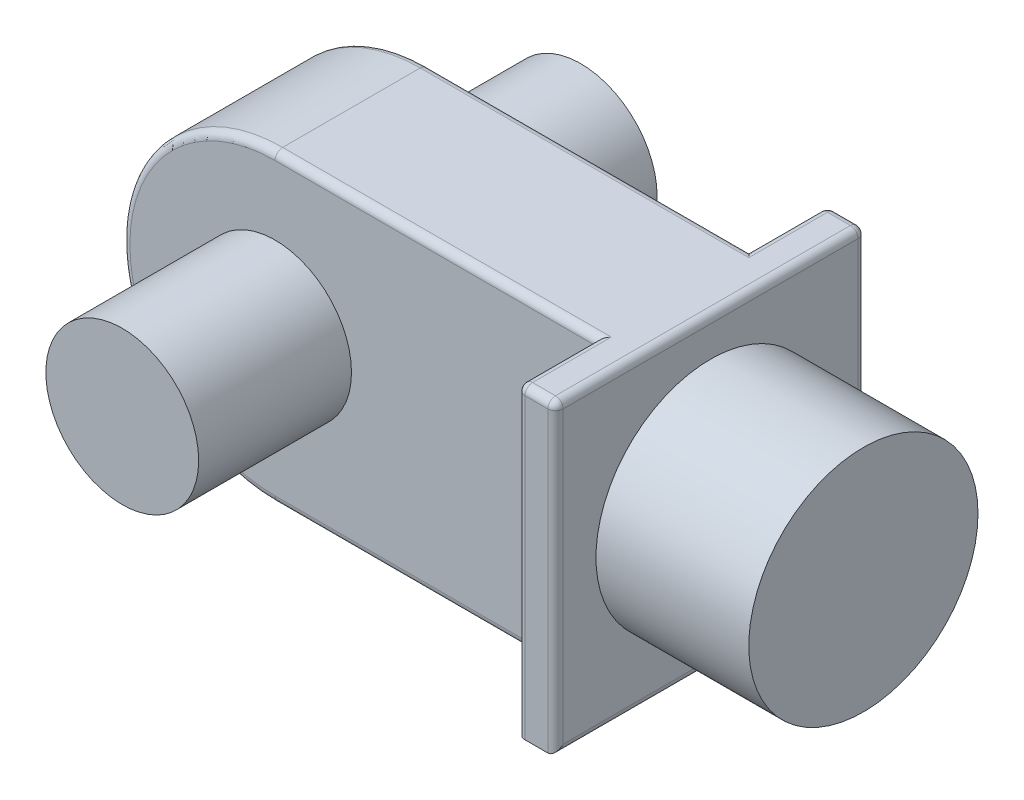
from build123d import *

# Parameters (mm, degrees)
BOSS_EXTRUDE1_DEPTH = 20
SKETCH2_R           = 10
BOSS_EXTRUDE2_DEPTH = 20
SKETCH3_W           = 40.597946668
SKETCH3_H           = 40
BOSS_EXTRUDE3_DEPTH = 5
SKETCH4_R           = 15
BOSS_EXTRUDE4_DEPTH = 20
FILLET1_R           = 1
L_EK2_SCALE         = 0.2


with BuildPart() as part:
    # Sketch1 → Boss-Extrude1 (new body)
    with BuildSketch(Plane.XY):
        with BuildLine():
            Line((-42, 20), (0, 20))
            Line((0, 20), (0, -20))
            Line((0, -20), (-42, -20))
            ThreePointArc((-42, -20), (-62, 0), (-42, 20))
        make_face()
    extrude(amount=BOSS_EXTRUDE1_DEPTH)

    # Sketch2 → Boss-Extrude2 (add)
    with BuildSketch(Plane.XY.offset(20)):
        with Locations((-42, 0)):
            Circle(SKETCH2_R)
    boss_extrude2 = extrude(amount=BOSS_EXTRUDE2_DEPTH)

    # Mirror1: Boss-Extrude2 across plane
    add(boss_extrude2.mirror(Plane.XY.offset(10)))

    # Sketch3 → Boss-Extrude3 (add)
    with BuildSketch(Plane(origin=(0, 0, 0), x_dir=(0, 0, -1), z_dir=(1, 0, 0))):
        with Locations((-10, 0)):
            Rectangle(SKETCH3_W, SKETCH3_H)
    extrude(amount=BOSS_EXTRUDE3_DEPTH)

    # Sketch4 → Boss-Extrude4 (add)
    with BuildSketch(Plane(origin=(5, 0, 0), x_dir=(0, 0, -1), z_dir=(1, 0, 0))):
        with Locations((-10, 0)):
            Circle(SKETCH4_R)
    extrude(amount=BOSS_EXTRUDE4_DEPTH)

    # Fillet1
    fillet1_edges = [part.edges().sort_by_distance(p)[0] for p in [
        (-21, 20, 20),
        (0, 0, -10.298973334),
        (0, 20, -5.149486667),
        (0, 20, 25.149486667),
        (2.5, 20, -10.298973334),
        (0, 0, 30.298973334),
        (2.5, 20, 30.298973334),
        (5, 0, -10.298973334),
        (5, 20, 10),
        (5, 0, 30.298973334),
        (5, -20, 10),
        (-62, 0, 20),
        (-21, 20, 0),
        (-21, -20, 0),
        (-62, 0, 0),
        (-21, -20, 20),
    ]]
    fillet(fillet1_edges, radius=FILLET1_R)


with BuildPart() as part_1:
    # Ölçek2: scaled about (-20.19862857, -0.001535567, 10)
    add(part.part.scale(L_EK2_SCALE).moved(Location((-16.158902856, -0.001228454, 8))))


solid = part_1.part
